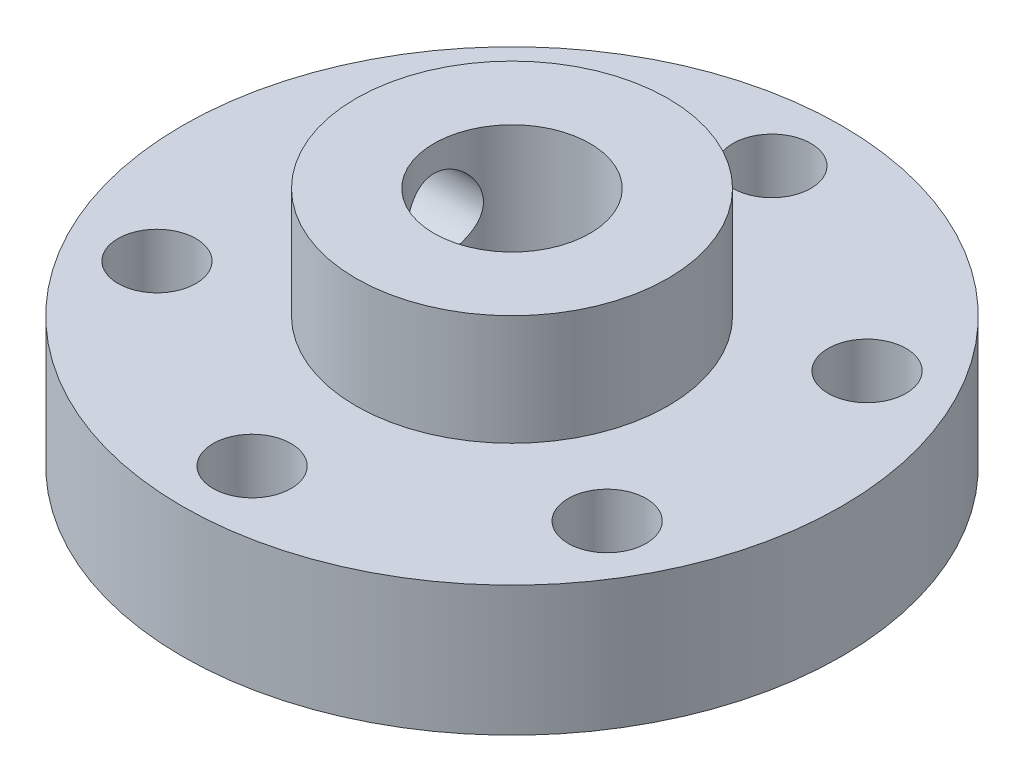
from build123d import *

# Parameters (mm, degrees)
SKETCH1_R           = 12.685
SKETCH1_R_2         = 3
BOSS_EXTRUDE1_DEPTH = 5
SKETCH2_R           = 6
SKETCH2_R_2         = 3
BOSS_EXTRUDE2_DEPTH = 9.25
SKETCH3_R           = 1.5
CUT_EXTRUDE1_DEPTH  = 12
SKETCH5_R           = 1.5
CUT_EXTRUDE3_DEPTH  = 21.183680289


with BuildPart() as part:
    # Sketch1 → Boss-Extrude1 (new body)
    with BuildSketch(Plane(origin=(0, 0, 0), x_dir=(1, 0, 0), z_dir=(0, 1, 0))):
        with Locations(Location((0, 0, 0), (0, 0, 270))):
            Circle(SKETCH1_R)
        with Locations(Location((0, 0, 0), (0, 0, 270))):
            Circle(SKETCH1_R_2, mode=Mode.SUBTRACT)
    extrude(amount=BOSS_EXTRUDE1_DEPTH)

    # Sketch2 → Boss-Extrude2 (add)
    with BuildSketch(Plane(origin=(0, 0, 0), x_dir=(1, 0, 0), z_dir=(0, 1, 0))):
        with Locations(Location((0, 0, 0), (0, 0, 270))):
            Circle(SKETCH2_R)
        with Locations(Location((0, 0, 0), (0, 0, 270))):
            Circle(SKETCH2_R_2, mode=Mode.SUBTRACT)
    extrude(amount=BOSS_EXTRUDE2_DEPTH)

    # Sketch3 → Cut-Extrude1 (cut)
    with BuildSketch(Plane(origin=(0, 0, 0), x_dir=(1, 0, 0), z_dir=(0, 1, 0))):
        with Locations(Location((0, 10, 0), (0, 0, 270))):
            Circle(SKETCH3_R)
        with Locations(Location((8.660254038, 5, 0), (0, 0, 270))):
            Circle(SKETCH3_R)
        with Locations(Location((8.660254038, -5, 0), (0, 0, 270))):
            Circle(SKETCH3_R)
        with Locations(Location((0, -10, 0), (0, 0, 270))):
            Circle(SKETCH3_R)
        with Locations(Location((-8.660254038, -5, 0), (0, 0, 270))):
            Circle(SKETCH3_R)
        with Locations(Location((-8.660254038, 5, 0), (0, 0, 270))):
            Circle(SKETCH3_R)
    extrude(amount=CUT_EXTRUDE1_DEPTH, mode=Mode.SUBTRACT)

    # Sketch5 → Cut-Extrude3 (cut, through all)
    with BuildSketch(Plane(origin=(0, 0, 0), x_dir=(0, -1, 0), z_dir=(1, 0, 0))):
        with Locations(Location((-6.75, 0, 0), (0, 0, 90))):
            Circle(SKETCH5_R)
        with Locations(Location((-2.5, 0, 0), (0, 0, 90))):
            Circle(SKETCH5_R)
    extrude(amount=-CUT_EXTRUDE3_DEPTH, mode=Mode.SUBTRACT)


solid = part.part
